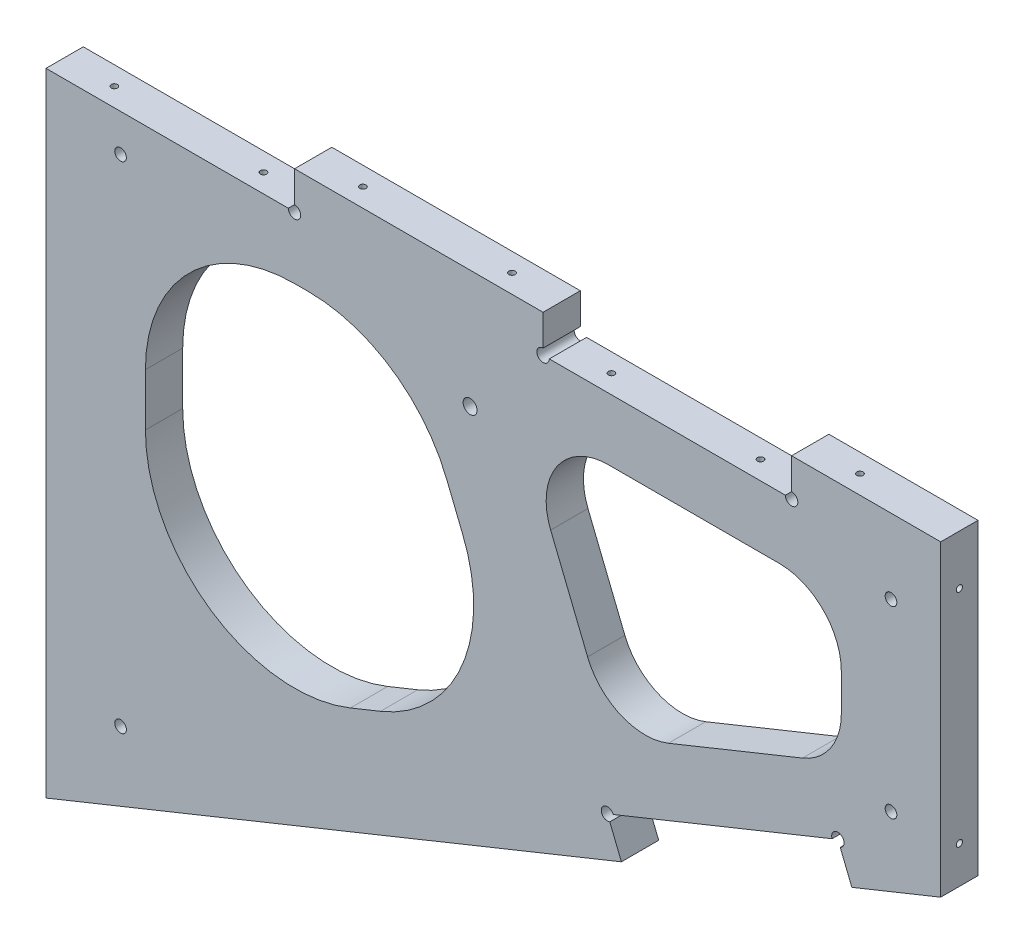
from build123d import *

# Parameters (mm, degrees)
BOSS_EXTRUDE1_DEPTH              = 19.05
CUT_EXTRUDE2_DEPTH               = 7658.473916494
FILLET1_R                        = 76.2
FILLET2_R                        = 31.75
SKETCH2_W                        = 127
SKETCH2_H                        = 19.05
CUT_EXTRUDE1_DEPTH               = 7658.473916494
F_1_4_0_25_DIAMETER_HOLE1_D      = 6.35
F_15_64_0_23438_DIAMETER_HOLE1_D = 5.953252
F_1_4_CLEARANCE_HOLE1_D          = 7.14248
HOLE1_D                          = 3.175
HOLE1_DEPTH                      = 50.8
HOLE1_CSINK_D                    = 10.16
HOLE1_CSINK_ANGLE                = 82
HOLE1_TIP                        = 0.953866233
HOLE2_D                          = 3.175
HOLE2_DEPTH                      = 38.1
HOLE2_CSINK_D                    = 10.16
HOLE2_CSINK_ANGLE                = 82
HOLE2_TIP                        = 0.953866233
HOLE3_D                          = 3.175
HOLE3_DEPTH                      = 50.8
HOLE3_CSINK_D                    = 10.16
HOLE3_CSINK_ANGLE                = 82
HOLE3_TIP                        = 0.953866233
HOLE4_D                          = 3.175
HOLE4_DEPTH                      = 38.1
HOLE4_CSINK_D                    = 10.16
HOLE4_CSINK_ANGLE                = 82
HOLE4_TIP                        = 0.953866233


with BuildPart() as part:
    # Sketch1 → Boss-Extrude1 (new body)
    with BuildSketch(Plane.XY):
        Polygon((3140.71, 6983.72999014), (2683.51, 6983.72999014), (2683.51, 6641.741886848), (3140.71, 6826.4626773), align=None)
    extrude(amount=BOSS_EXTRUDE1_DEPTH)

    # Sketch6 → Cut-Extrude2 (cut, through all)
    with BuildSketch(Plane(origin=(0, 0, 0), x_dir=(-1, 0, 0), z_dir=(0, 0, -1))):
        Polygon((-2923.76447292, 6932.92999014), (-3089.91, 6932.92999014), (-3089.91, 6860.727709955), (-2972.15765047, 6813.152672592), align=None)
        Polygon((-2925.056710658, 6794.122657646), (-2734.31, 6717.055984048), (-2734.31, 6932.92999014), (-2868.974907992, 6932.92999014), align=None)
    extrude(amount=-CUT_EXTRUDE2_DEPTH, mode=Mode.SUBTRACT)

    # Fillet1
    fillet1_edges = [part.edges().sort_by_distance(p)[0] for p in [
        (2925.056710658, 6794.122657646, 9.525),
        (2868.974907992, 6932.92999014, 9.525),
        (2734.31, 6932.92999014, 9.525),
        (2734.31, 6717.055984048, 9.525),
    ]]
    fillet(fillet1_edges, radius=FILLET1_R)

    # Fillet2
    fillet2_edges = [part.edges().sort_by_distance(p)[0] for p in [
        (2972.15765047, 6813.152672592, 9.525),
        (3089.91, 6860.727709955, 9.525),
        (3089.91, 6932.92999014, 9.525),
        (2923.76447292, 6932.92999014, 9.525),
    ]]
    fillet(fillet2_edges, radius=FILLET2_R)

    # Sketch2 → Cut-Extrude1 (cut, through all)
    with BuildSketch(Plane(origin=(0, 0, 0), x_dir=(-1, 0, 0), z_dir=(0, 0, -1))):
        with Locations((-2747.01, 6974.20499014)):
            Rectangle(SKETCH2_W, SKETCH2_H)
        with Locations((-3001.01, 6974.20499014)):
            Rectangle(SKETCH2_W, SKETCH2_H)
        Polygon((-2977.551881268, 6760.542518374), (-3095.304230798, 6808.117555738), (-3088.167975193, 6825.780408168), (-2970.415625663, 6778.205370804), align=None)
    extrude(amount=-CUT_EXTRUDE1_DEPTH, mode=Mode.SUBTRACT)

    # 1/4 (0.25) Diameter Hole1 (through all)
    with Locations(Plane(origin=(0, 0, 0), x_dir=(-1, 0, 0), z_dir=(0, 0, -1))):
        with Locations((-3088.167975193, 6825.780408168), (-2970.415625663, 6778.205370804), (-2937.51, 6964.67999014), (-3064.51, 6964.67999014), (-2810.51, 6964.67999014)):
            Hole(F_1_4_0_25_DIAMETER_HOLE1_D / 2)

    # 15/64 (0.23438) Diameter Hole1 (through all)
    with Locations(Plane.YX):
        with Locations((6692.541891629, 2721.610000001), (6945.629994921, 2721.610000001), (6945.629994921, 3115.310000001), (6851.60701674, 3115.310000001)):
            Hole(F_15_64_0_23438_DIAMETER_HOLE1_D / 2)

    # 1/4 Clearance Hole1 (through all)
    with Locations(Plane(origin=(0, 0, 0), x_dir=(-1, 0, 0), z_dir=(0, 0, -1))):
        with Locations((-2900.218040257, 6923.40499014)):
            Hole(F_1_4_CLEARANCE_HOLE1_D / 2)

    # Hole1
    with Locations(Plane(origin=(0, 7002.77999014, 247.523), x_dir=(0, 0, 1), z_dir=(0, 1, 0))):
        with Locations((0, 2696.21), (-237.998, 3089.91), (-237.998, 3039.11), (-237.998, 2962.91), (-237.998, 2912.11), (-237.998, 2835.91), (-237.998, 2785.11), (-237.998, 2708.91), (237.998, 2708.91), (237.998, 2785.11), (237.998, 2835.91), (237.998, 2912.11), (237.998, 2962.91), (237.998, 3039.11), (237.998, 3089.91), (0, 3051.81), (0, 2950.21), (0, 2797.81)):
            CounterSinkHole(HOLE1_D / 2, HOLE1_CSINK_D / 2, depth=HOLE1_DEPTH, counter_sink_angle=HOLE1_CSINK_ANGLE)
            with Locations((0, 0, -(HOLE1_DEPTH + HOLE1_TIP / 2))):  # 118° drill point
                Cone(0, HOLE1_D / 2, HOLE1_TIP, mode=Mode.SUBTRACT)

    # Hole2
    with Locations(Plane(origin=(3159.76, -4.781e-06, 247.523), x_dir=(0, 0, -1), z_dir=(1, 0, 0))):
        with Locations((-118.999, 6993.254994921), (237.998, 6993.254994921), (237.998, 6958.329994921), (237.998, 6845.512682081), (-237.998, 6993.254994921), (-237.998, 6958.329994921), (-237.998, 6845.512682081), (118.999, 6993.254994921)):
            CounterSinkHole(HOLE2_D / 2, HOLE2_CSINK_D / 2, depth=HOLE2_DEPTH, counter_sink_angle=HOLE2_CSINK_ANGLE)
            with Locations((0, 0, -(HOLE2_DEPTH + HOLE2_TIP / 2))):  # 118° drill point
                Cone(0, HOLE2_D / 2, HOLE2_TIP, mode=Mode.SUBTRACT)

    # Hole3
    with Locations(Plane(origin=(-1923.157317923, 4759.981389861, 247.523), x_dir=(0, 0, -1), z_dir=(0.37460659341595665, -0.9271838545667693, 0))):
        with Locations((237.998, 5442.50683469), (-237.998, 5442.50683469), (-237.998, 5394.88183469), (-237.998, 5318.68183469), (0, 5407.58183469), (0, 5305.98183469), (-237.998, 5267.88183469), (-237.998, 5130.866292514), (-237.998, 4993.850750338), (237.998, 4993.850750338), (237.998, 5130.866292514), (237.998, 5267.88183469), (237.998, 5318.68183469), (237.998, 5394.88183469)):
            CounterSinkHole(HOLE3_D / 2, HOLE3_CSINK_D / 2, depth=HOLE3_DEPTH, counter_sink_angle=HOLE3_CSINK_ANGLE)
            with Locations((0, 0, -(HOLE3_DEPTH + HOLE3_TIP / 2))):  # 118° drill point
                Cone(0, HOLE3_D / 2, HOLE3_TIP, mode=Mode.SUBTRACT)

    # Hole4
    with Locations(Plane(origin=(2664.46, -4.781e-06, 247.523), x_dir=(0, 0, 1), z_dir=(-1, 0, 0))):
        with Locations((-237.998, 6686.191891629), (237.998, 6686.191891629), (257.048, 6993.254994921), (218.948, 6993.254994921), (19.05, 6993.254994921), (237.998, 6939.279994921), (237.998, 6812.735943275), (-237.998, 6812.735943275), (-237.998, 6939.279994921), (-19.05, 6993.254994921), (-218.948, 6993.254994921), (-257.048, 6993.254994921)):
            CounterSinkHole(HOLE4_D / 2, HOLE4_CSINK_D / 2, depth=HOLE4_DEPTH, counter_sink_angle=HOLE4_CSINK_ANGLE)
            with Locations((0, 0, -(HOLE4_DEPTH + HOLE4_TIP / 2))):  # 118° drill point
                Cone(0, HOLE4_D / 2, HOLE4_TIP, mode=Mode.SUBTRACT)


solid = part.part
